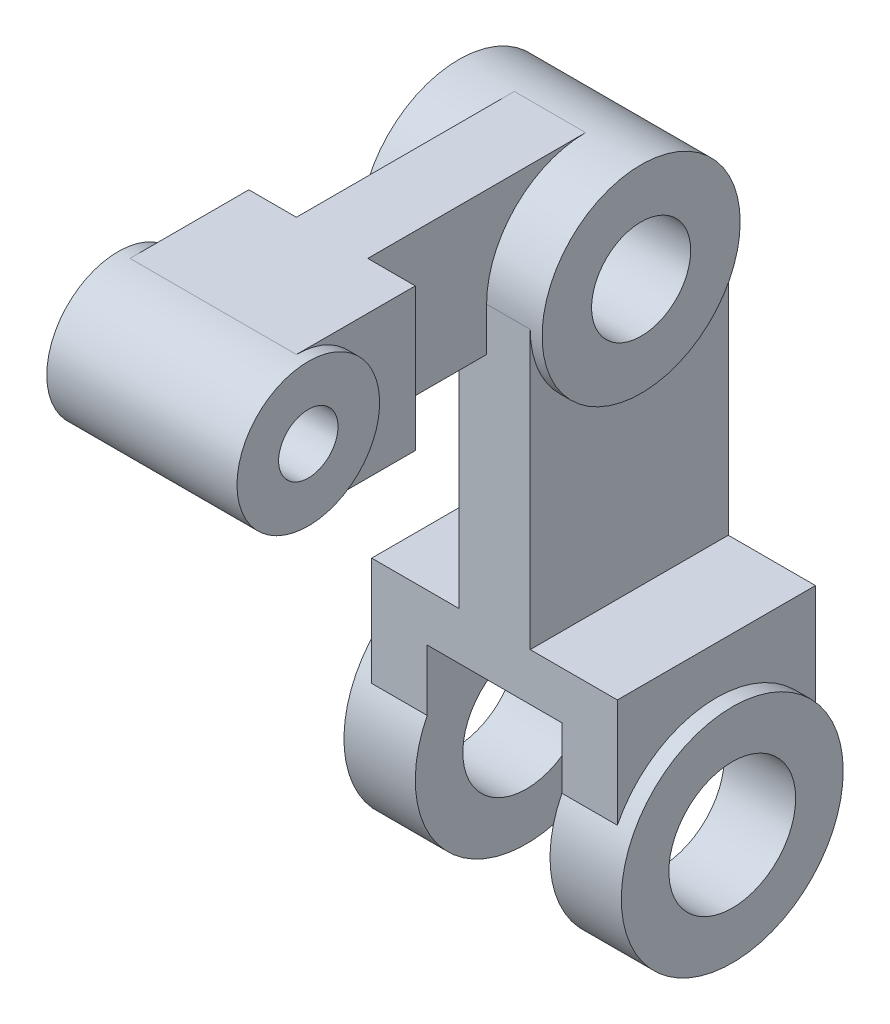
from build123d import *

# Parameters (mm, degrees)
SKETCH1_R               = 28
SKETCH1_R_2             = 16
BOSS_EXTRUDE1_DEPTH     = 35
BOSS_EXTRUDE4_DEPTH     = 31
BOSS_EXTRUDE8_DEPTH     = 9
BOSS_EXTRUDE10_START    = 12
SKETCH6_8_R             = 12.5
BOSS_EXTRUDE10_DEPTH    = 12
SKETCH6_9_R             = 12.5
BOSS_EXTRUDE11_DEPTH    = 34
CUT_EXTRUDE2_DEPTH      = 143.246265329
CUT_EXTRUDE2_DEPTH_BACK = 143.246265329
SKETCH8_W               = 34
SKETCH8_H               = 56
SKETCH9_W               = 18
SKETCH9_H               = 36
BOSS_EXTRUDE12_DEPTH    = 55
CUT_EXTRUDE3_DEPTH      = 150.916643506
CUT_EXTRUDE3_DEPTH_BACK = 150.916643506
SKETCH12_R              = 12.5
SKETCH18_W              = 42
SKETCH18_H              = 36
BOSS_EXTRUDE15_DEPTH    = 30
CUT_EXTRUDE8_DEPTH      = 167.03011775
CUT_EXTRUDE8_DEPTH_BACK = 167.03011775
SKETCH30_R              = 7.5
SKETCH31_R              = 18
BOSS_EXTRUDE18_DEPTH    = 24
CUT_EXTRUDE9_DEPTH      = 176.926120858
CUT_EXTRUDE9_DEPTH_BACK = 176.926120858
SKETCH30_2_R            = 7.5


with BuildPart() as part:
    # Sketch1 → Boss-Extrude1 (new, symmetric)
    with BuildSketch(Plane(origin=(0, 0, 0), x_dir=(0, 0, -1), z_dir=(1, 0, 0))):
        Circle(SKETCH1_R)
        Circle(SKETCH1_R_2, mode=Mode.SUBTRACT)
    extrude(amount=BOSS_EXTRUDE1_DEPTH, both=True)

    # Sketch2 → Boss-Extrude4 (add, symmetric)
    with BuildSketch(Plane(origin=(0, 0, 0), x_dir=(0, 0, -1), z_dir=(1, 0, 0))):
        with BuildLine():
            Line((-25, 40), (25, 40))
            Line((25, 40), (25, 12.609520213))
            ThreePointArc((25, 12.609520213), (0, 28), (-25, 12.609520213))
            Line((-25, 12.609520213), (-25, 40))
        make_face()
    extrude(amount=BOSS_EXTRUDE4_DEPTH, both=True)

    # Sketch6 → Boss-Extrude8 (add, symmetric)
    with BuildSketch(Plane(origin=(0, 0, 0), x_dir=(0, 0, -1), z_dir=(1, 0, 0))):
        with BuildLine():
            Line((-25, 110), (-25, 40))
            Line((-25, 40), (25, 40))
            Line((25, 40), (25, 110))
            ThreePointArc((25, 110), (0, 85), (-25, 110))
        make_face()
    extrude(amount=BOSS_EXTRUDE8_DEPTH, both=True)

    # Sketch6<8> → Boss-Extrude10 (add)
    with BuildSketch(Plane(origin=(0, 0, 0), x_dir=(0, 0, -1), z_dir=(1, 0, 0)).offset(BOSS_EXTRUDE10_START)):
        with BuildLine():
            ThreePointArc((25, 110), (0, 135), (-25, 110))
            ThreePointArc((-25, 110), (0, 85), (25, 110))
        make_face()
        with Locations((0, 110)):
            Circle(SKETCH6_8_R, mode=Mode.SUBTRACT)
    extrude(amount=-BOSS_EXTRUDE10_DEPTH)

    # Sketch6<9> → Boss-Extrude11 (add)
    with BuildSketch(Plane(origin=(0, 0, 0), x_dir=(0, 0, -1), z_dir=(1, 0, 0))):
        with BuildLine():
            ThreePointArc((25, 110), (0, 135), (-25, 110))
            ThreePointArc((-25, 110), (0, 85), (25, 110))
        make_face()
        with Locations((0, 110)):
            Circle(SKETCH6_9_R, mode=Mode.SUBTRACT)
    extrude(amount=-BOSS_EXTRUDE11_DEPTH)

    # Sketch8 → Cut-Extrude2 (cut, two sides: drawn at the far end of the back side and taken through both)
    with BuildSketch(Plane.XY.offset(-CUT_EXTRUDE2_DEPTH_BACK)):
        Rectangle(SKETCH8_W, SKETCH8_H)
    extrude(amount=CUT_EXTRUDE2_DEPTH + CUT_EXTRUDE2_DEPTH_BACK, mode=Mode.SUBTRACT)

    # Sketch9 → Boss-Extrude12 (add)
    with BuildSketch(Plane.XY):
        with Locations((-11, 117)):
            Rectangle(SKETCH9_W, SKETCH9_H)
    extrude(amount=BOSS_EXTRUDE12_DEPTH)

    # Sketch12 → Cut-Extrude3 (cut, two sides: drawn at the far end of the back side and taken through both)
    with BuildSketch(Plane(origin=(0, 0, 0), x_dir=(0, 0, -1), z_dir=(1, 0, 0)).offset(-CUT_EXTRUDE3_DEPTH_BACK)):
        with Locations((0, 110)):
            Circle(SKETCH12_R)
    extrude(amount=CUT_EXTRUDE3_DEPTH + CUT_EXTRUDE3_DEPTH_BACK, mode=Mode.SUBTRACT)

    # Sketch18 → Boss-Extrude15 (add)
    with BuildSketch(Plane.XY.offset(55)):
        with Locations((-11, 117)):
            Rectangle(SKETCH18_W, SKETCH18_H)
    extrude(amount=BOSS_EXTRUDE15_DEPTH)

    # Sketch30 → Cut-Extrude8 (cut, two sides: drawn at the far end of the back side and taken through both)
    with BuildSketch(Plane.ZY.offset(11).offset(-CUT_EXTRUDE8_DEPTH_BACK)):
        with Locations((85, 117)):
            Circle(SKETCH30_R)
    extrude(amount=CUT_EXTRUDE8_DEPTH + CUT_EXTRUDE8_DEPTH_BACK, mode=Mode.SUBTRACT)

    # Sketch31 → Boss-Extrude18 (add, symmetric)
    with BuildSketch(Plane.ZY.offset(11)):
        with Locations((85, 117)):
            Circle(SKETCH31_R)
    extrude(amount=BOSS_EXTRUDE18_DEPTH, both=True)

    # Sketch30<2> → Cut-Extrude9 (cut, two sides: drawn at the far end of the back side and taken through both)
    with BuildSketch(Plane.ZY.offset(11).offset(-CUT_EXTRUDE9_DEPTH_BACK)):
        with Locations((85, 117)):
            Circle(SKETCH30_2_R)
    extrude(amount=CUT_EXTRUDE9_DEPTH + CUT_EXTRUDE9_DEPTH_BACK, mode=Mode.SUBTRACT)


solid = part.part
